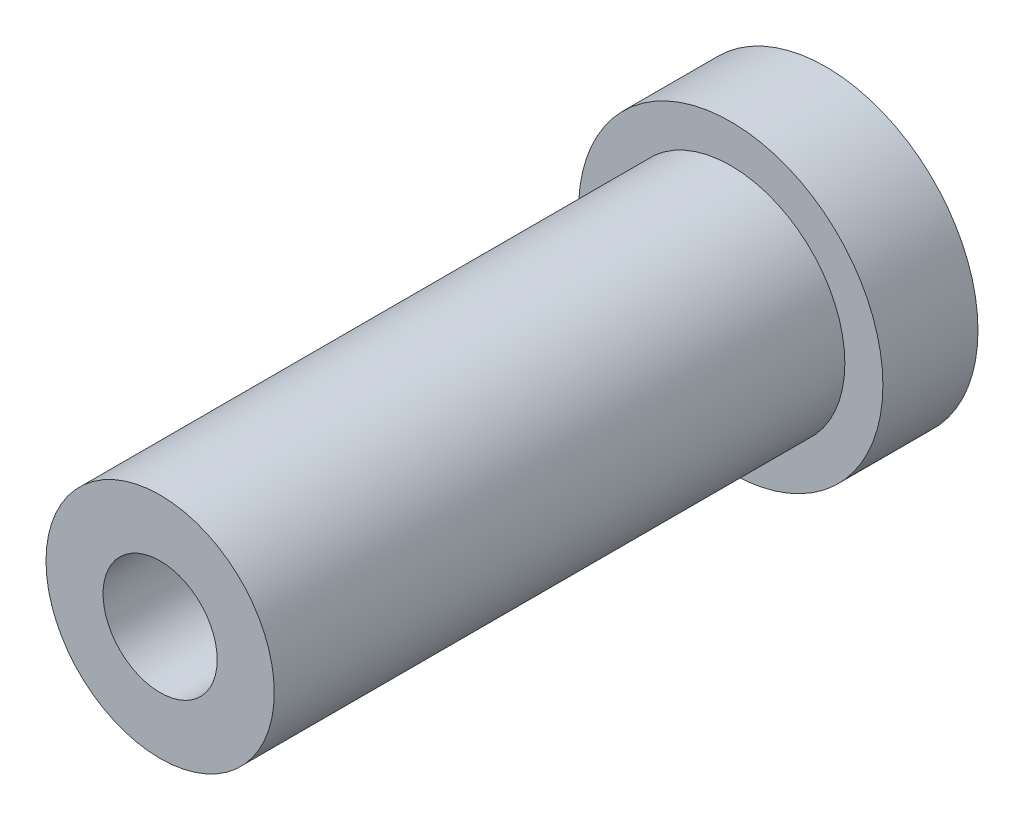
from build123d import *

# Parameters (mm, degrees)
SKETCH1_R           = 4
BOSS_EXTRUDE1_DEPTH = 2.5
SKETCH4_R           = 3
BOSS_EXTRUDE2_DEPTH = 15
SKETCH5_R           = 1.5
CUT_EXTRUDE1_DEPTH  = 15


with BuildPart() as part:
    # Sketch1 → Boss-Extrude1 (new body)
    with BuildSketch(Plane.XY):
        Circle(SKETCH1_R)
    extrude(amount=BOSS_EXTRUDE1_DEPTH)

    # Sketch4 → Boss-Extrude2 (add)
    with BuildSketch(Plane.XY.offset(2.5)):
        Circle(SKETCH4_R)
    extrude(amount=BOSS_EXTRUDE2_DEPTH)

    # Sketch5 → Cut-Extrude1 (cut)
    with BuildSketch(Plane.XY.offset(17.5)):
        Circle(SKETCH5_R)
    extrude(amount=-CUT_EXTRUDE1_DEPTH, mode=Mode.SUBTRACT)


solid = part.part
